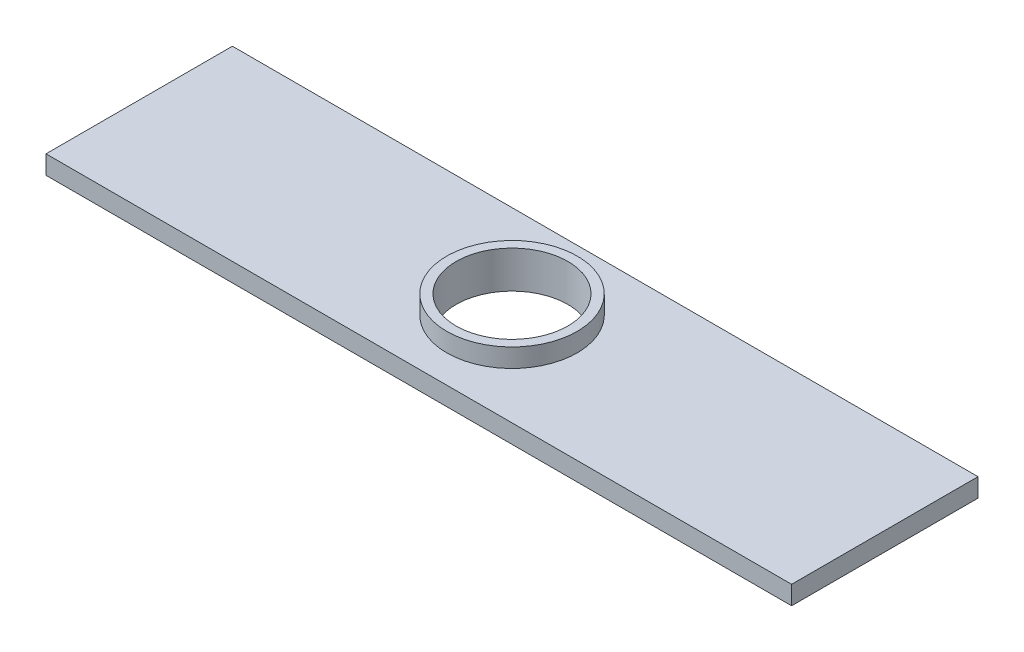
from build123d import *

# Parameters (mm, degrees)
SKETCH1_R           = 17.5
SKETCH1_R_2         = 15
BOSS_EXTRUDE1_DEPTH = 5
BOSS_EXTRUDE2_START = -5
SKETCH1_3_W         = 200
SKETCH1_3_H         = 50
SKETCH1_3_R         = 15
BOSS_EXTRUDE2_DEPTH = 5


with BuildPart() as part:
    # Sketch1 → Boss-Extrude1 (new body)
    with BuildSketch(Plane(origin=(0, 0, 0), x_dir=(1, 0, 0), z_dir=(0, 1, 0))):
        Circle(SKETCH1_R)
        Circle(SKETCH1_R_2, mode=Mode.SUBTRACT)
    extrude(amount=BOSS_EXTRUDE1_DEPTH)

    # Sketch1<3> → Boss-Extrude2 (add)
    with BuildSketch(Plane(origin=(0, 0, 0), x_dir=(1, 0, 0), z_dir=(0, 1, 0)).offset(BOSS_EXTRUDE2_START)):
        Rectangle(SKETCH1_3_W, SKETCH1_3_H)
        Circle(SKETCH1_3_R, mode=Mode.SUBTRACT)
    extrude(amount=BOSS_EXTRUDE2_DEPTH)


solid = part.part
